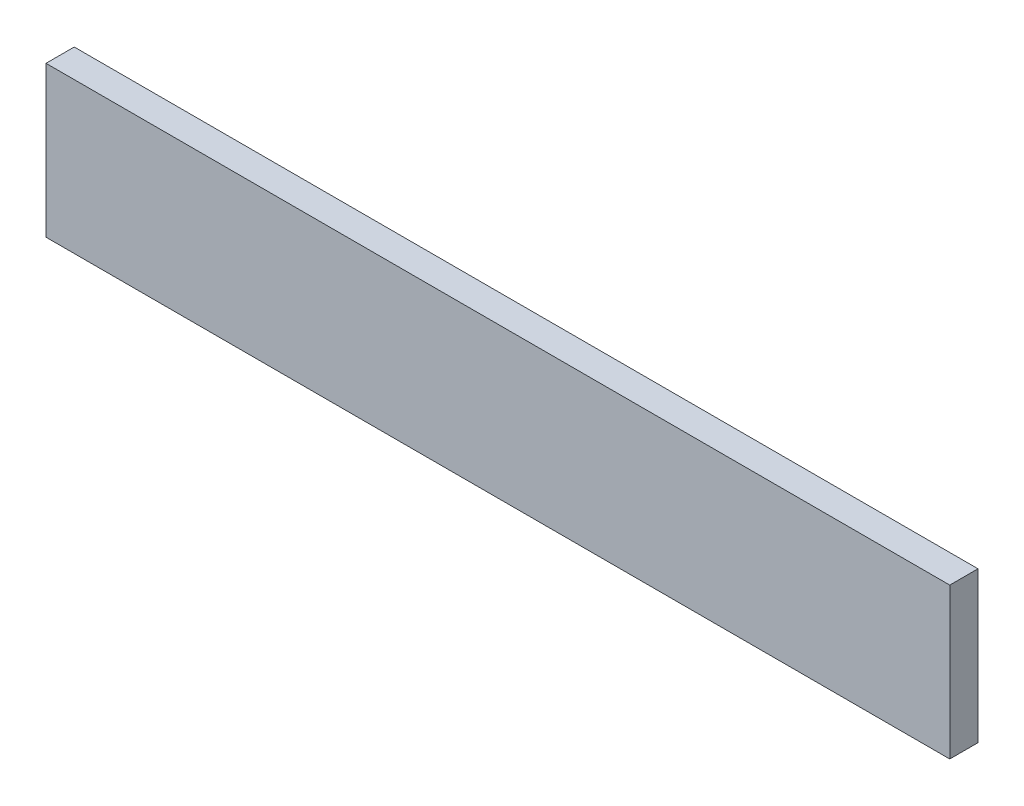
from build123d import *

# Parameters (mm, degrees)
SKETCH1_W           = 304.8
SKETCH1_H           = 50.8
BOSS_EXTRUDE1_DEPTH = 9.525


with BuildPart() as part:
    # Sketch1 → Boss-Extrude1 (new body)
    with BuildSketch(Plane.XY):
        with Locations((152.4, 25.4)):
            Rectangle(SKETCH1_W, SKETCH1_H)
    extrude(amount=BOSS_EXTRUDE1_DEPTH)


solid = part.part
